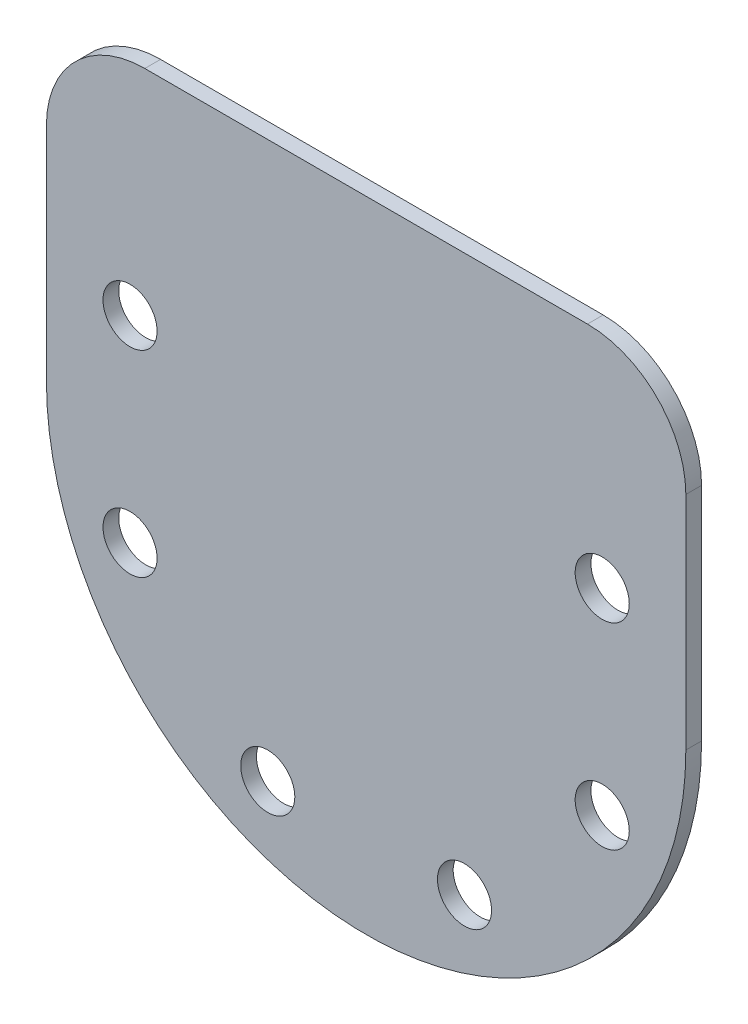
from build123d import *

# Parameters (mm, degrees)
BOSS_EXTRUDE1_DEPTH  = 1.6002
M5_CLEARANCE_HOLE1_D = 5.5
FILLET1_R            = 10


with BuildPart() as part:
    # Sketch1 → Boss-Extrude1 (new body)
    with BuildSketch(Plane.XY):
        with BuildLine():
            Line((-32.5, 0), (-32.5, 32.5))
            Line((-32.5, 32.5), (32.5, 32.5))
            Line((32.5, 32.5), (32.5, 0))
            ThreePointArc((32.5, 0), (0, -32.5), (-32.5, 0))
        make_face()
    extrude(amount=BOSS_EXTRUDE1_DEPTH)

    # M5 Clearance Hole1 (through all)
    with Locations(Plane.XY.offset(1.6002)):
        with Locations((24, -10), (10, -24), (-10, -24), (-24, -10), (-24, 10), (24, 10)):
            Hole(M5_CLEARANCE_HOLE1_D / 2)

    # Fillet1
    fillet1_edges = [part.edges().sort_by_distance(p)[0] for p in [
        (-32.5, 32.5, 0.8001),
        (32.5, 32.5, 0.8001),
    ]]
    fillet(fillet1_edges, radius=FILLET1_R)


solid = part.part
